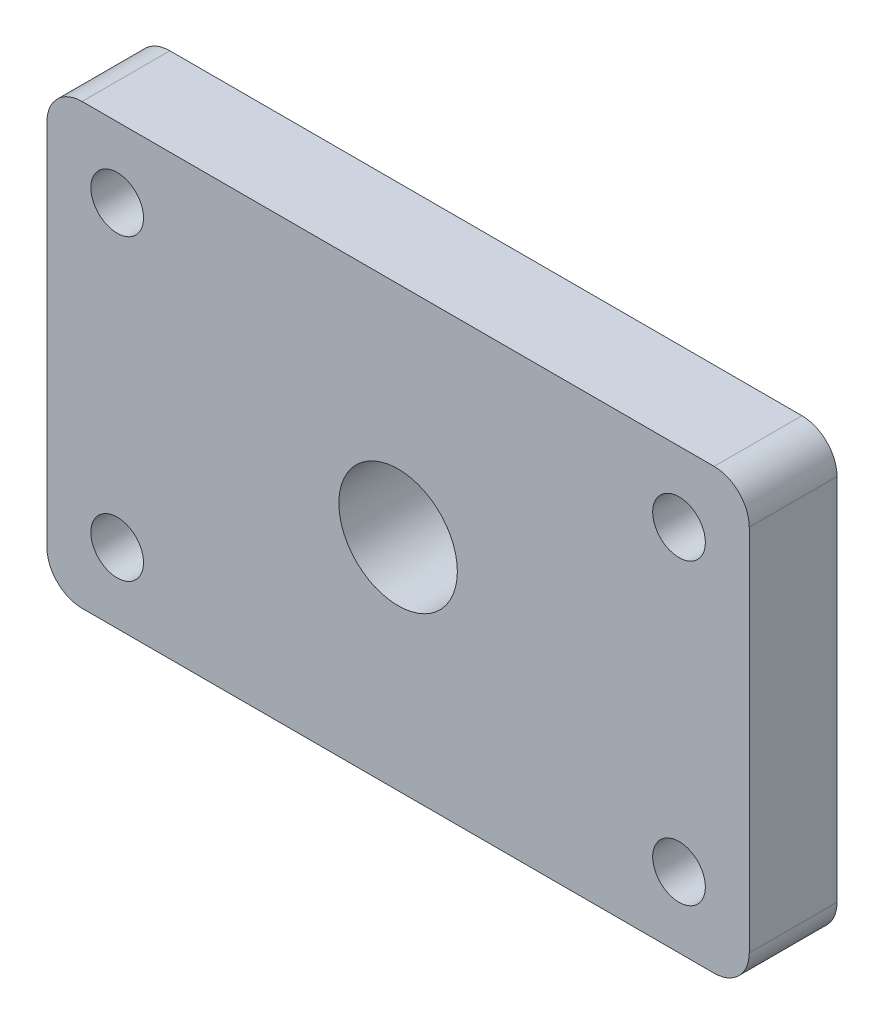
from build123d import *

# Parameters (mm, degrees)
MODEL_R             = 3
MODEL_R_2           = 6.75
BOSS_EXTRUDE1_DEPTH = 10


with BuildPart() as part:
    # Model → Boss-Extrude1 (new body)
    with BuildSketch(Plane.XY):
        with BuildLine():
            Line((-36, -25), (36, -25))
            ThreePointArc((36, -25), (38.828427125, -23.828427125), (40, -21))
            Line((40, -21), (40, 21))
            ThreePointArc((40, 21), (38.828427125, 23.828427125), (36, 25))
            Line((36, 25), (-36, 25))
            ThreePointArc((-36, 25), (-38.828427125, 23.828427125), (-40, 21))
            Line((-40, 21), (-40, -21))
            ThreePointArc((-40, -21), (-38.828427125, -23.828427125), (-36, -25))
        make_face()
        with Locations((-32, 17)):
            Circle(MODEL_R, mode=Mode.SUBTRACT)
        with Locations((32, -17)):
            Circle(MODEL_R, mode=Mode.SUBTRACT)
        with Locations((32, 17)):
            Circle(MODEL_R, mode=Mode.SUBTRACT)
        with Locations((-32, -17)):
            Circle(MODEL_R, mode=Mode.SUBTRACT)
        Circle(MODEL_R_2, mode=Mode.SUBTRACT)
    extrude(amount=BOSS_EXTRUDE1_DEPTH)


solid = part.part
